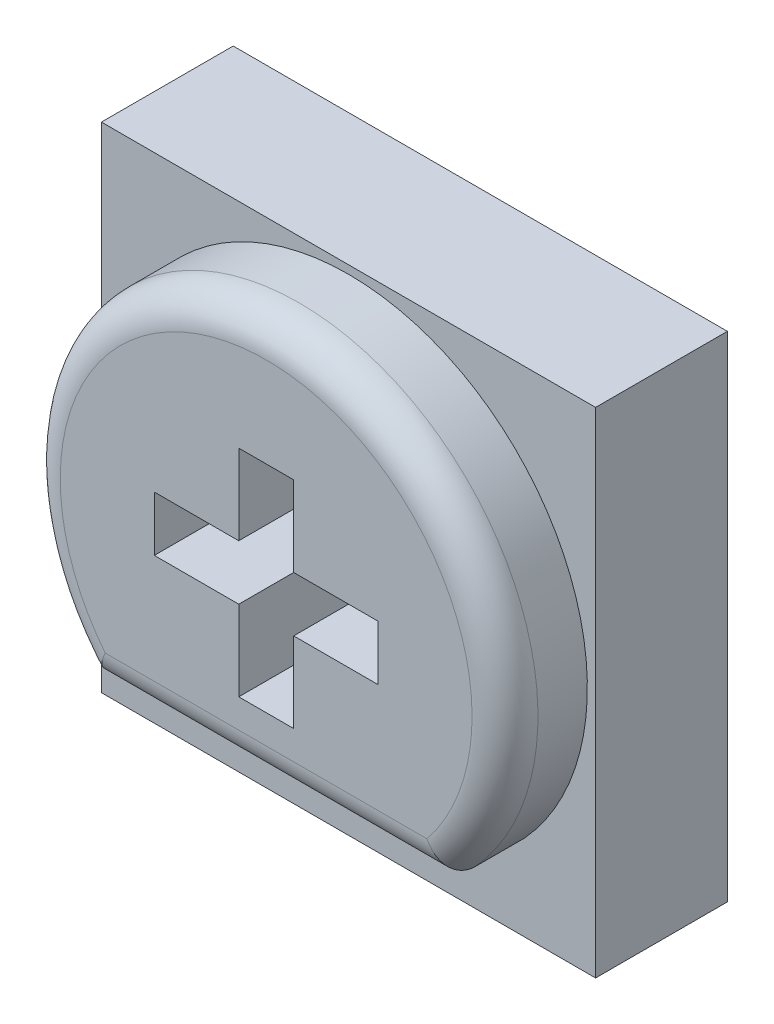
from build123d import *

# Parameters (mm, degrees)
SKETCH1_W           = 3
SKETCH1_H           = 3
BOSS_EXTRUDE1_DEPTH = 0.8
BOSS_EXTRUDE2_DEPTH = 0.5
CUT_EXTRUDE1_DEPTH  = 0.8
FILLET1_R           = 0.2


with BuildPart() as part:
    # Sketch1 → Boss-Extrude1 (new body)
    with BuildSketch(Plane.XY):
        Rectangle(SKETCH1_W, SKETCH1_H)
    extrude(amount=BOSS_EXTRUDE1_DEPTH)

    # Sketch2 → Boss-Extrude2 (add)
    with BuildSketch(Plane.XY.offset(0.8)):
        with BuildLine():
            Line((-1.068624141, -0.980072674), (1.068624141, -0.980072674))
            ThreePointArc((1.068624141, -0.980072674), (0, 1.45), (-1.068624141, -0.980072674))
        make_face()
    extrude(amount=BOSS_EXTRUDE2_DEPTH)

    # Sketch3 → Cut-Extrude1 (cut)
    with BuildSketch(Plane.XY.offset(1.3)):
        Polygon((-0.166229868, 0.215595899), (-0.166229868, 0.702775387), (0.167103465, 0.702775387), (0.167103465, 0.215595899), (0.679923978, 0.215595899), (0.679923978, -0.117737434), (0.167103465, -0.117737434), (0.167103465, -0.604916921), (-0.166229868, -0.604916921), (-0.166229868, -0.117737434), (-0.679050381, -0.117737434), (-0.679050381, 0.215595899), align=None)
    extrude(amount=-CUT_EXTRUDE1_DEPTH, mode=Mode.SUBTRACT)

    # Fillet1
    fillet1_edges = [part.edges().sort_by_distance(p)[0] for p in [
        (0, 1.45, 1.3),
        (0, -0.980072674, 1.3),
    ]]
    fillet(fillet1_edges, radius=FILLET1_R)


solid = part.part
